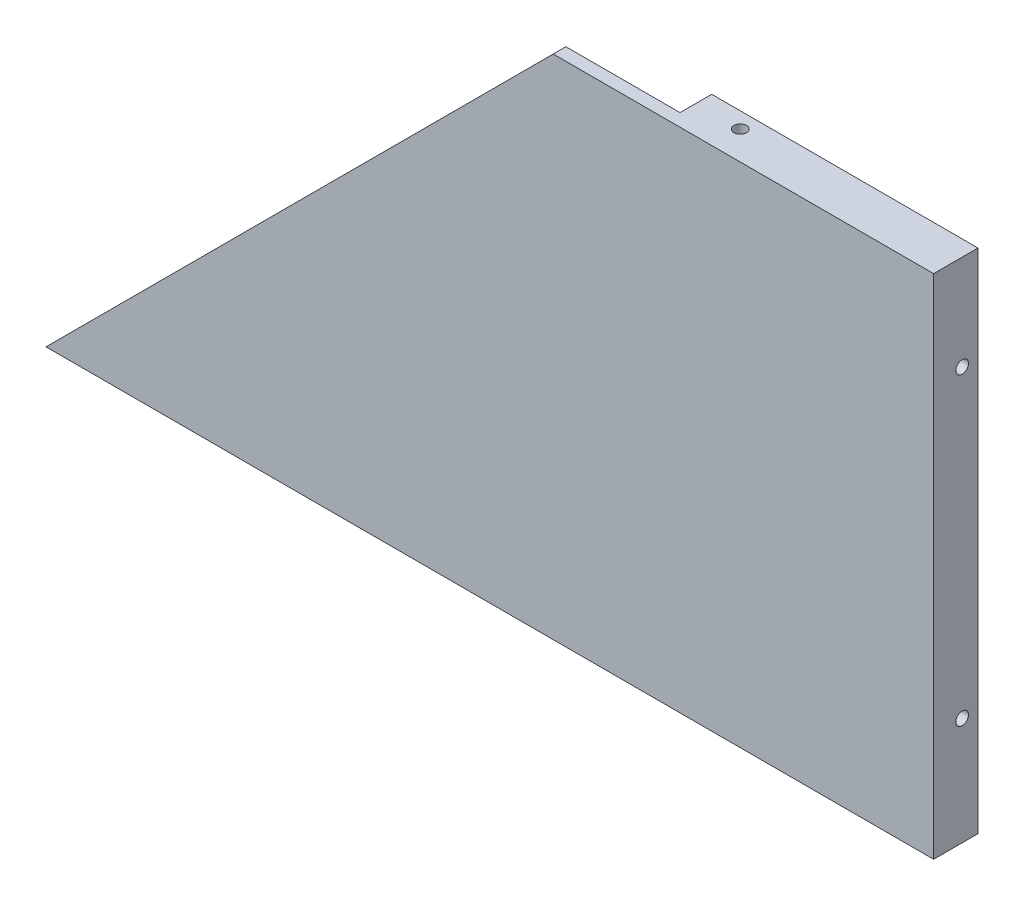
from build123d import *

# Parameters (mm, degrees)
EXTRUDE_1_DEPTH = 4
SKETCH_3_W      = 260
SKETCH_3_H      = 10
SKETCH_3_R      = 2
EXTRUDE_2_DEPTH = 4
SKETCH_4_W      = 10
SKETCH_4_H      = 156
SKETCH_4_R      = 2
EXTRUDE_3_DEPTH = 4
EXTRUDE_START   = -4
SKETCH_5_W      = 80
SKETCH_5_H      = 10
SKETCH_5_R      = 2
EXTRUDE_4_DEPTH = 4
SKETCH_7_W      = 10
SKETCH_7_H      = 166.274169979
SKETCH_7_R      = 2
EXTRUDE_5_DEPTH = 4


with BuildPart() as part:
    # 草图1 → 凸台-拉伸1 (new body)
    with BuildSketch(Plane.XY):
        Polygon((0, 0), (-280, 0), (-120, 160), (0, 160), align=None)
    extrude(amount=EXTRUDE_1_DEPTH)

    # 草图3 → 凸台-拉伸2 (add)
    with BuildSketch(Plane.XZ):
        with Locations((-130, -5)):
            Rectangle(SKETCH_3_W, SKETCH_3_H)
        with Locations(Location((-210, -5, 0), (0, 0, 270))):
            Circle(SKETCH_3_R, mode=Mode.SUBTRACT)
        with Locations(Location((-140, -5, 0), (0, 0, 270))):
            Circle(SKETCH_3_R, mode=Mode.SUBTRACT)
        with Locations(Location((-70, -5, 0), (0, 0, 270))):
            Circle(SKETCH_3_R, mode=Mode.SUBTRACT)
    extrude(amount=-EXTRUDE_2_DEPTH)

    # 草图4 → 凸台-拉伸3 (add)
    with BuildSketch(Plane(origin=(0, 0, 0), x_dir=(0, 0, -1), z_dir=(1, 0, 0))):
        with Locations((5, 82)):
            Rectangle(SKETCH_4_W, SKETCH_4_H)
        with Locations(Location((5, 34, 0), (0, 0, 90))):
            Circle(SKETCH_4_R, mode=Mode.SUBTRACT)
        with Locations(Location((5, 130, 0), (0, 0, 90))):
            Circle(SKETCH_4_R, mode=Mode.SUBTRACT)
    extrude(amount=-EXTRUDE_3_DEPTH)

    # 草图5 → 凸台-拉伸4 (add)
    with BuildSketch(Plane(origin=(0, 160, 0), x_dir=(1, 0, 0), z_dir=(0, 1, 0)).offset(EXTRUDE_START)):
        with Locations((-44, 5)):
            Rectangle(SKETCH_5_W, SKETCH_5_H)
        with Locations(Location((-70, 5, 0), (0, 0, 90))):
            Circle(SKETCH_5_R, mode=Mode.SUBTRACT)
    extrude(amount=EXTRUDE_4_DEPTH)

    # 草图7 → 凸台-拉伸5 (add)
    with BuildSketch(Plane(origin=(-140, 140, 0), x_dir=(0, 0, 1), z_dir=(-0.707106781186544, 0.7071067811865511, 0))):
        with Locations((-5, -74.852813743)):
            Rectangle(SKETCH_7_W, SKETCH_7_H)
        with Locations(Location((-5, -11.715728753, 0), (0, 0, 270))):
            Circle(SKETCH_7_R, mode=Mode.SUBTRACT)
        with Locations(Location((-5, -137.989898732, 0), (0, 0, 270))):
            Circle(SKETCH_7_R, mode=Mode.SUBTRACT)
    extrude(amount=-EXTRUDE_5_DEPTH)


solid = part.part
